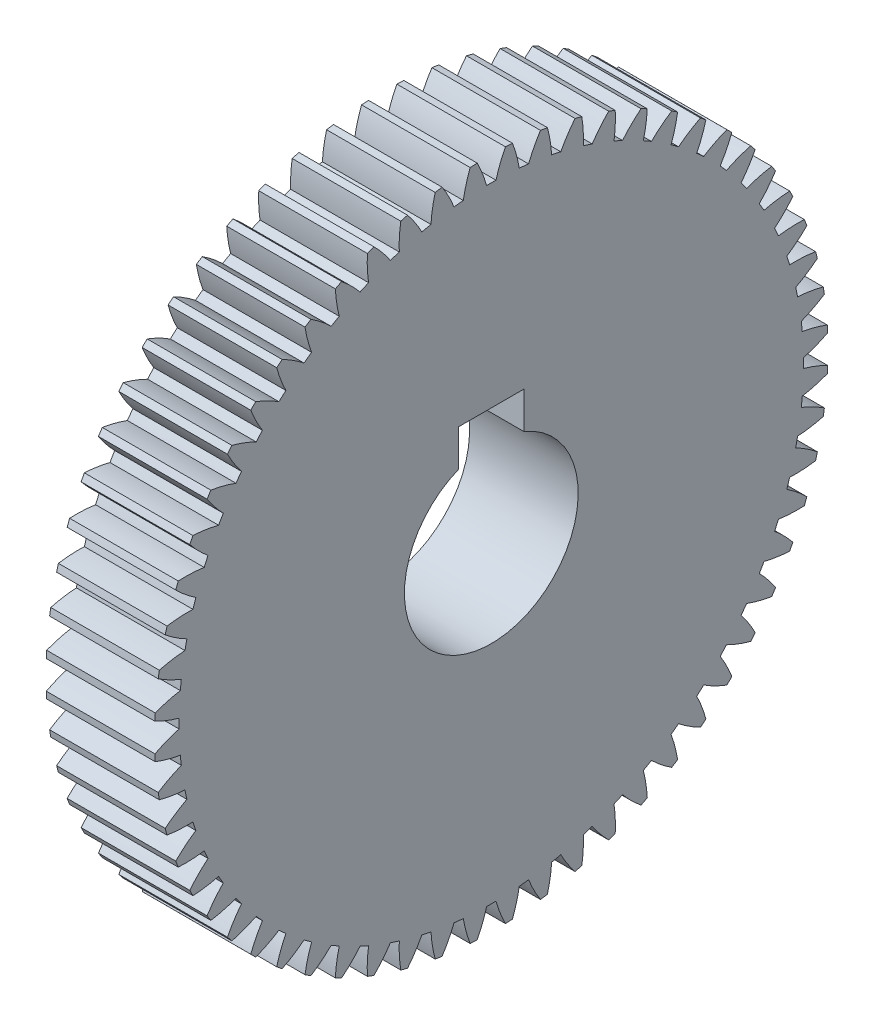
from build123d import *

# Parameters (mm, degrees)
BASPROSKE_W     = 5
BASPROSKE_H     = 15.5
TOOTHCUT_DEPTH  = 23.483327156
TEETHCUTS_COUNT = 60
TEETHCUTS_ANGLE = 354
BORSKE_R        = 4
BORE_DEPTH      = 50.0000508
KEYSKE_W        = 3
KEYSKE_H        = 5.4
KEYWAY_DEPTH    = 50.0000508


with BuildPart() as part:
    # BasProSke → Base-Revolve (revolve)
    with BuildSketch(Plane(origin=(0, 0, 0), x_dir=(1, 0, 0), z_dir=(0, 1, 0)), mode=Mode.PRIVATE) as base_revolve_sk:
        with Locations((2.5, 7.75)):
            Rectangle(BASPROSKE_W, BASPROSKE_H)
    revolve(base_revolve_sk.sketch.rotate(Axis((-10, 0, 0), (1, 0, 0)), 180), axis=Axis((-10, 0, 0), (1, 0, 0)))

    # TooCutSke → ToothCut (cut, through all)
    with BuildSketch(Plane(origin=(0, 0, 0), x_dir=(0, 0, -1), z_dir=(1, 0, 0))):
        with BuildLine():
            ThreePointArc((0.21493681, 14.372392917), (0, 14.374), (-0.21493681, 14.372392917))
            ThreePointArc((-0.21493681, 14.372392917), (-0.409732631, 14.953266942), (-0.662749221, 15.51124781))
            ThreePointArc((-0.662749221, 15.51124781), (0, 15.5254), (0.662749221, 15.51124781))
            ThreePointArc((0.662749221, 15.51124781), (0.409732631, 14.953266942), (0.21493681, 14.372392917))
        make_face()
    toothcut = extrude(amount=TOOTHCUT_DEPTH, mode=Mode.SUBTRACT)

    # TeethCuts: ToothCut ×60 about axis
    teethcuts_axis = Axis((-10, 0, 0), (1, 0, 0))
    for i in range(1, TEETHCUTS_COUNT):
        add(toothcut.rotate(teethcuts_axis, i * TEETHCUTS_ANGLE / (TEETHCUTS_COUNT - 1)), mode=Mode.SUBTRACT)

    # BorSke → Bore (cut, symmetric)
    with BuildSketch(Plane(origin=(0, 0, 0), x_dir=(0, 0, -1), z_dir=(1, 0, 0))):
        with Locations(Location((0, 0, 0), (0, 0, 180))):
            Circle(BORSKE_R)
    extrude(amount=BORE_DEPTH, both=True, mode=Mode.SUBTRACT)

    # KeySke → Keyway (cut, symmetric)
    with BuildSketch(Plane(origin=(0, 0, 0), x_dir=(0, 0, -1), z_dir=(1, 0, 0))):
        with Locations((0, 2.7)):
            Rectangle(KEYSKE_W, KEYSKE_H)
    extrude(amount=KEYWAY_DEPTH, both=True, mode=Mode.SUBTRACT)


solid = part.part
